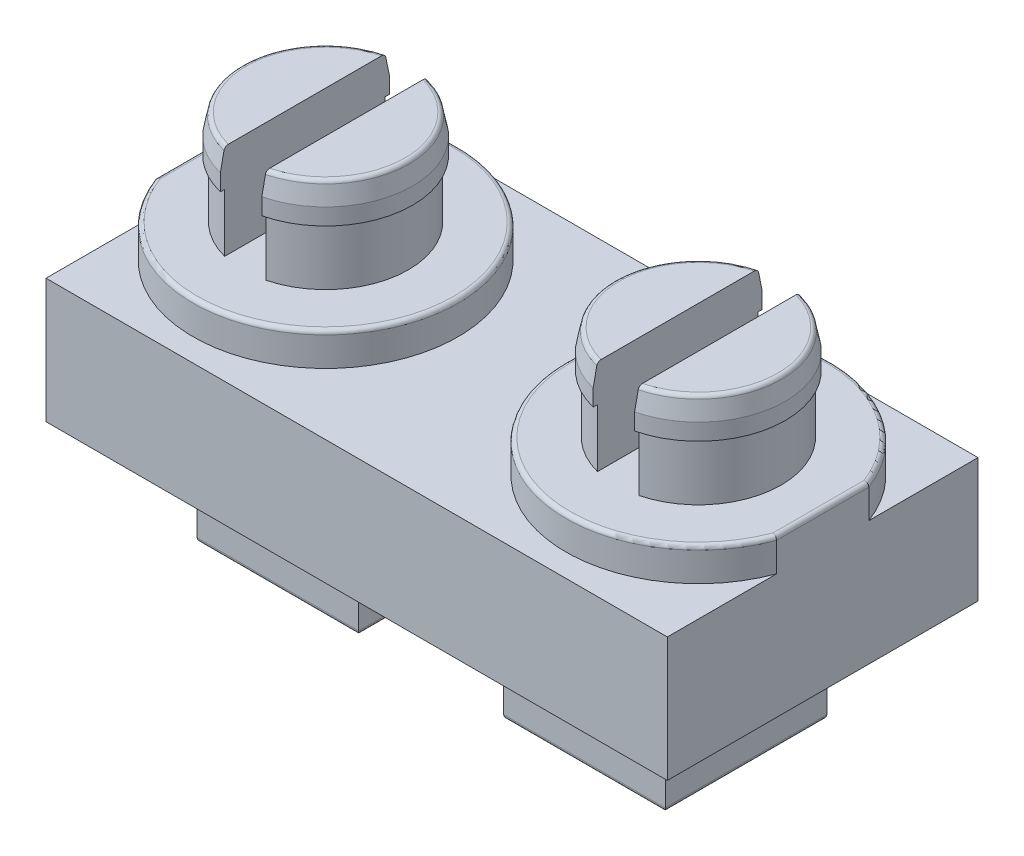
from build123d import *

# Parameters (mm, degrees)
SKETCH_1_W             = 7.5
SKETCH_1_H             = 7.5
EXTRUDE_1_DEPTH        = 3
EXTRUDE_2_DEPTH        = 7.5
CUT_EXTRUDE_1_DEPTH    = 7.5
SKETCH_5_R             = 3.2
EXTRUDE_3_DEPTH        = 0.8
SKETCH_6_R             = 2
EXTRUDE_4_DEPTH        = 2.3
SKETCH_8_W             = 1
SKETCH_8_H             = 6
CUT_EXTRUDE_2_DEPTH    = 2.3
SKETCH_9_W             = 1.018557721
SKETCH_9_H             = 7.5
CUT_EXTRUDE_5_DEPTH    = 0.8
FILLET_2_R             = 0.1
FILLET_2_OF_MIRROR_1_R = 0.1


with BuildPart() as part:
    # 草图1 → 凸台-拉伸1 (new body)
    with BuildSketch(Plane(origin=(0, 0, 0), x_dir=(1, 0, 0), z_dir=(0, 1, 0))):
        with Locations((3.75, 0)):
            Rectangle(SKETCH_1_W, SKETCH_1_H)
    extrude_1 = extrude(amount=EXTRUDE_1_DEPTH)

    # 草图3 → 凸台-拉伸2 (add)
    with BuildSketch(Plane.XY.offset(3.75)):
        with BuildLine():
            Line((5.2, 0), (2.2, 0))
            Line((2.2, 0), (2.2, -0.677124344))
            ThreePointArc((2.2, -0.677124344), (1.919957697, -1.088161527), (1.75, -1.555590279))
            Line((1.75, -1.555590279), (1.75, -2.5))
            Line((1.75, -2.5), (5.65, -2.5))
            Line((5.65, -2.5), (5.65, -1.555590279))
            ThreePointArc((5.65, -1.555590279), (5.480042303, -1.088161527), (5.2, -0.677124344))
            Line((5.2, -0.677124344), (5.2, 0))
        make_face()
    extrude_2 = extrude(amount=-EXTRUDE_2_DEPTH)

    # 草图4 → 切除-拉伸1 (cut)
    with BuildSketch(Plane(origin=(7.5, 0, 0), x_dir=(0, 0, -1), z_dir=(1, 0, 0))):
        with BuildLine():
            Line((1.5, 0), (3.75, 0))
            Line((3.75, 0), (3.75, -2.5))
            Line((3.75, -2.5), (1.95, -2.5))
            Line((1.95, -2.5), (1.95, -1.555590279))
            ThreePointArc((1.95, -1.555590279), (1.780042303, -1.088161527), (1.5, -0.677124344))
            Line((1.5, -0.677124344), (1.5, 0))
        make_face()
        with BuildLine():
            Line((-1.5, 0), (-1.5, -0.677124344))
            ThreePointArc((-1.5, -0.677124344), (-1.780042303, -1.088161527), (-1.95, -1.555590279))
            Line((-1.95, -1.555590279), (-1.95, -2.5))
            Line((-1.95, -2.5), (-3.75, -2.5))
            Line((-3.75, -2.5), (-3.75, 0))
            Line((-3.75, 0), (-1.5, 0))
        make_face()
    cut_extrude_1 = extrude(amount=-CUT_EXTRUDE_1_DEPTH, mode=Mode.SUBTRACT)

    # 草图5 → 凸台-拉伸3 (add)
    with BuildSketch(Plane(origin=(0, 3, 0), x_dir=(1, 0, 0), z_dir=(0, 1, 0))):
        with Locations(Location((4.5, 0, 0), (0, 0, 20.364134806))):
            Circle(SKETCH_5_R)
    extrude_3 = extrude(amount=EXTRUDE_3_DEPTH)

    # 草图6 → 凸台-拉伸4 (add)
    with BuildSketch(Plane(origin=(0, 3.8, 0), x_dir=(1, 0, 0), z_dir=(0, 1, 0))):
        with Locations(Location((4.5, 0, 0), (0, 0, 270))):
            Circle(SKETCH_6_R)
    extrude_4 = extrude(amount=EXTRUDE_4_DEPTH)

    # 草图7 → 旋转1 (revolve)
    with BuildSketch(Plane.XY, mode=Mode.PRIVATE) as revolve_1_sk:
        Polygon((2.5, 6.1), (2.5, 5.2), (2.4, 5.2), (2.4, 5.6), align=None)
    revolve_1 = revolve(revolve_1_sk.sketch.rotate(Axis((4.5, 6.1, 0), (0, -1, 0)), 270), axis=Axis((4.5, 6.1, 0), (0, -1, 0)))

    # 草图8 → 切除-拉伸2 (cut)
    with BuildSketch(Plane(origin=(0, 6.1, 0), x_dir=(1, 0, 0), z_dir=(0, 1, 0))):
        with Locations((4.5, 0)):
            Rectangle(SKETCH_8_W, SKETCH_8_H)
    cut_extrude_2 = extrude(amount=-CUT_EXTRUDE_2_DEPTH, mode=Mode.SUBTRACT)

    # 草图9 → 切除-拉伸5 (cut)
    with BuildSketch(Plane(origin=(0, 3, 0), x_dir=(1, 0, 0), z_dir=(0, 1, 0))):
        with Locations((8.009278861, 0)):
            Rectangle(SKETCH_9_W, SKETCH_9_H)
    cut_extrude_5 = extrude(amount=CUT_EXTRUDE_5_DEPTH, mode=Mode.SUBTRACT)

    # 圆角2
    fillet_2_edges = [part.edges().sort_by_distance(p)[0] for p in [
        (5.65, -2.5, 0),
        (3.7, -2.5, -1.95),
        (1.75, -2.5, 0),
        (3.7, -2.5, 1.95),
        (7.5, 3.8, 0),
        (1.3, 3.8, 0),
        (2.5, 6.1, 0),
        (6.5, 6.1, 0),
    ]]
    fillet(fillet_2_edges, radius=FILLET_2_R)

    # 镜向1: 凸台-拉伸1, 凸台-拉伸2, 切除-拉伸1, 凸台-拉伸3, 凸台-拉伸4, 旋转1, 切除-拉伸2, 切除-拉伸5 across plane
    add(extrude_1.mirror(Plane(origin=(0, 0, 0), x_dir=(0, 0, 1), z_dir=(1, 0, 0))))
    add(extrude_2.mirror(Plane(origin=(0, 0, 0), x_dir=(0, 0, 1), z_dir=(1, 0, 0))))
    add(cut_extrude_1.mirror(Plane(origin=(0, 0, 0), x_dir=(0, 0, 1), z_dir=(1, 0, 0))), mode=Mode.SUBTRACT)
    add(extrude_3.mirror(Plane(origin=(0, 0, 0), x_dir=(0, 0, 1), z_dir=(1, 0, 0))))
    add(extrude_4.mirror(Plane(origin=(0, 0, 0), x_dir=(0, 0, 1), z_dir=(1, 0, 0))))
    add(revolve_1.mirror(Plane(origin=(0, 0, 0), x_dir=(0, 0, 1), z_dir=(1, 0, 0))))
    add(cut_extrude_2.mirror(Plane(origin=(0, 0, 0), x_dir=(0, 0, 1), z_dir=(1, 0, 0))), mode=Mode.SUBTRACT)
    add(cut_extrude_5.mirror(Plane(origin=(0, 0, 0), x_dir=(0, 0, 1), z_dir=(1, 0, 0))), mode=Mode.SUBTRACT)

    # 圆角2 of 镜向1
    fillet_2_of_mirror_1_edges = [part.edges().sort_by_distance(p)[0] for p in [
        (-5.65, -2.5, 0),
        (-3.7, -2.5, -1.95),
        (-1.75, -2.5, 0),
        (-3.7, -2.5, 1.95),
        (-7.5, 3.8, 0),
        (-1.3, 3.8, 0),
        (-2.5, 6.1, 0),
        (-6.5, 6.1, 0),
    ]]
    fillet(fillet_2_of_mirror_1_edges, radius=FILLET_2_OF_MIRROR_1_R)


solid = part.part
